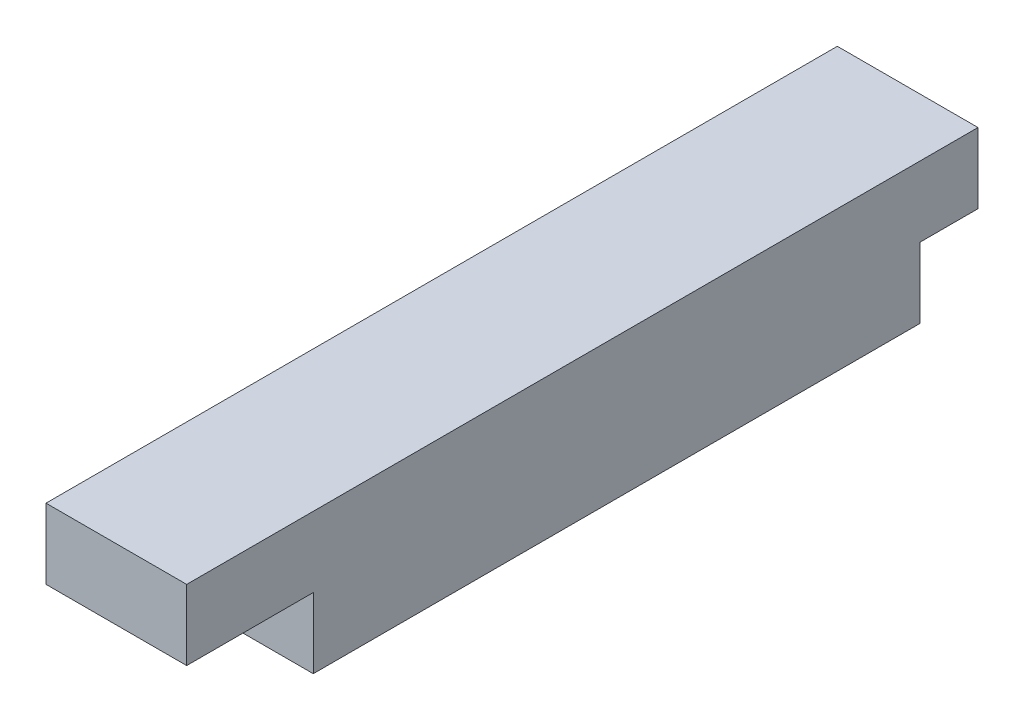
from build123d import *

# Parameters (mm, degrees)
CROQUIS1_W              = 8
CROQUIS1_H              = 45
SALIENTE_EXTRUIR1_DEPTH = 4
CROQUIS2_W              = 5
CROQUIS2_H              = 34.5
SALIENTE_EXTRUIR2_DEPTH = 4


with BuildPart() as part:
    # Croquis1 → Saliente-Extruir1 (new body)
    with BuildSketch(Plane(origin=(0, 0, 0), x_dir=(1, 0, 0), z_dir=(0, 1, 0))):
        with Locations((4, 22.5)):
            Rectangle(CROQUIS1_W, CROQUIS1_H)
    extrude(amount=SALIENTE_EXTRUIR1_DEPTH)

    # Croquis2 → Saliente-Extruir2 (add)
    with BuildSketch(Plane.XZ):
        with Locations((5.5, -24.45)):
            Rectangle(CROQUIS2_W, CROQUIS2_H)
    extrude(amount=SALIENTE_EXTRUIR2_DEPTH)


solid = part.part
